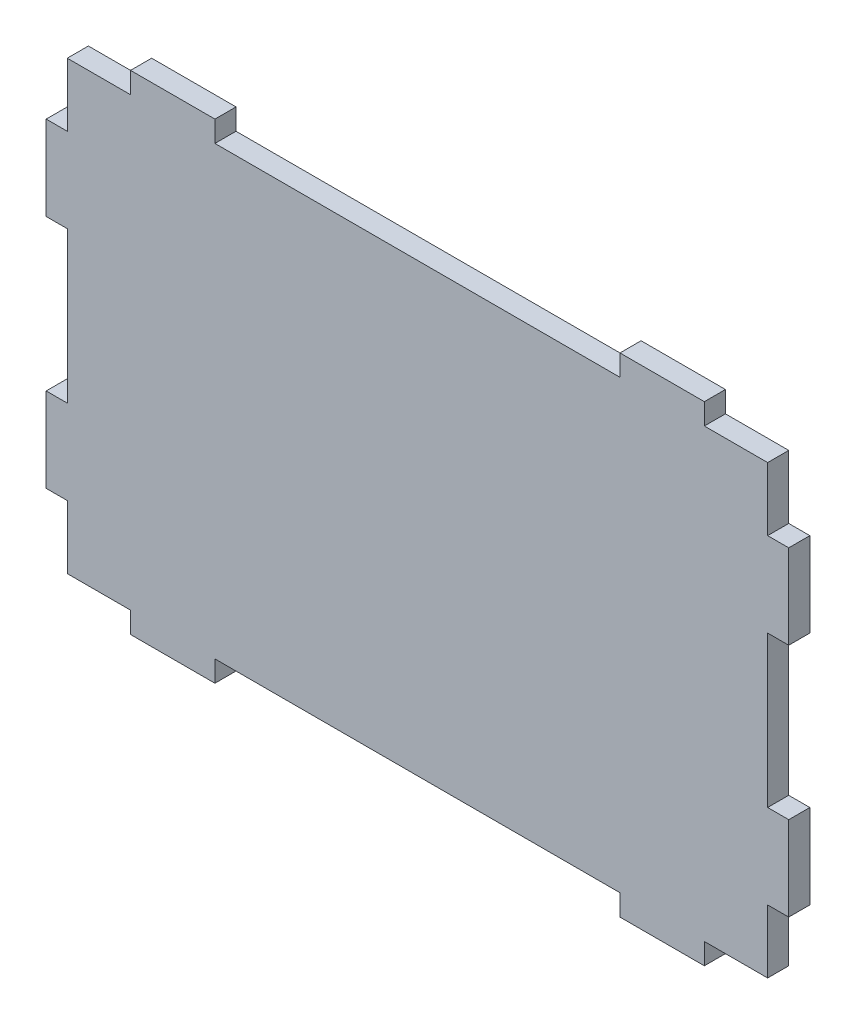
from build123d import *

# Parameters (mm, degrees)
SALIENTE_EXTRUIR1_DEPTH = 5


with BuildPart() as part:
    # Croquis1 → Saliente-Extruir1 (new body)
    with BuildSketch(Plane.XY):
        Polygon((80.798987429, 65.937910328), (60.798987429, 65.937910328), (60.798987429, 60.937910328), (-35.201012571, 60.937910328), (-35.201012571, 65.937910328), (-55.201012571, 65.937910328), (-55.201012571, 60.937910328), (-70.201012571, 60.937910328), (-70.201012571, 45.937910328), (-75.201012571, 45.937910328), (-75.201012571, 25.937910328), (-70.201012571, 25.937910328), (-70.201012571, -9.862089672), (-75.201012571, -9.862089672), (-75.201012571, -29.862089672), (-70.201012571, -29.862089672), (-70.201012571, -44.862089672), (-55.201012571, -44.862089672), (-55.201012571, -49.862089672), (-35.201012571, -49.862089672), (-35.201012571, -44.862089672), (60.798987429, -44.862089672), (60.798987429, -49.862089672), (80.798987429, -49.862089672), (80.798987429, -44.862089672), (95.798987429, -44.862089672), (95.798987429, -29.862089672), (100.798987429, -29.862089672), (100.798987429, -9.862089672), (95.798987429, -9.862089672), (95.798987429, 25.937910328), (100.798987429, 25.937910328), (100.798987429, 45.937910328), (95.798987429, 45.937910328), (95.798987429, 60.937910328), (80.798987429, 60.937910328), align=None)
    extrude(amount=SALIENTE_EXTRUIR1_DEPTH)


solid = part.part
